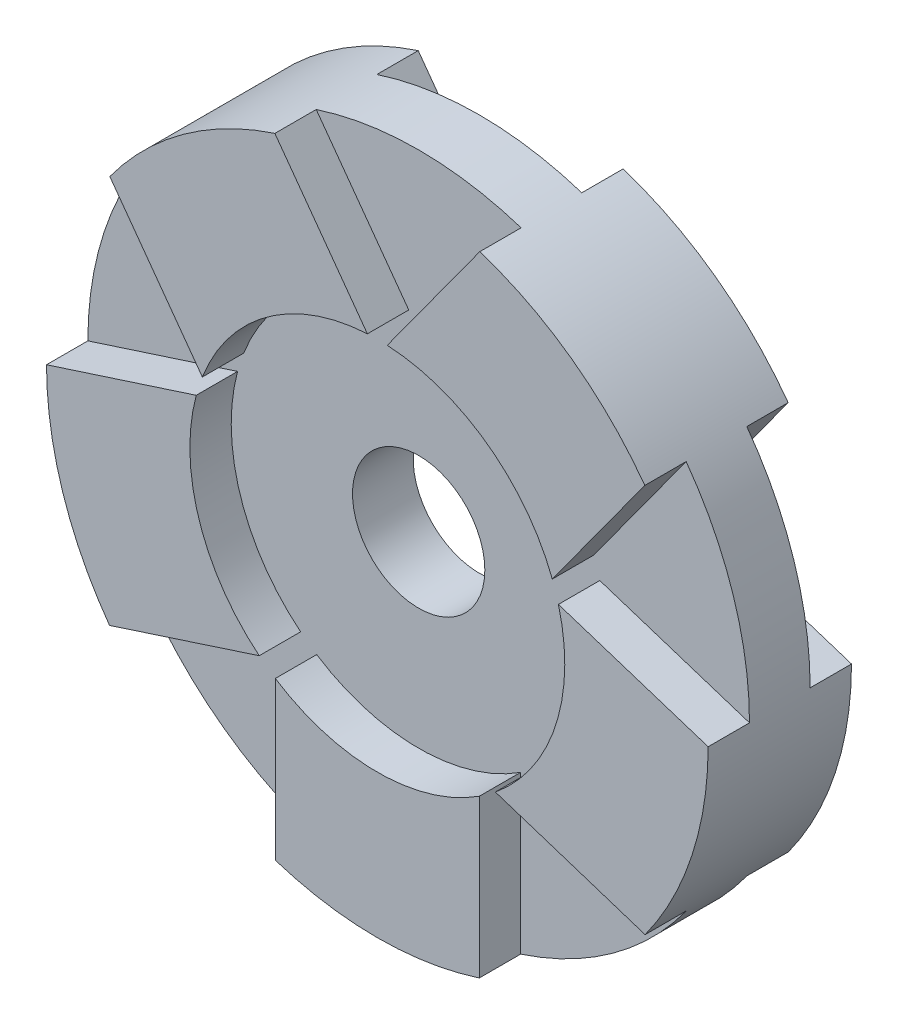
from build123d import *

# Parameters (mm, degrees)
BOSS_EXTRU_1_DEPTH      = 6.5
BOSS_EXTRU_1_DEPTH_BACK = 6.5
ESQUISSE1_R             = 30
ESQUISSE1_R_2           = 6
ESQUISSE3_R             = 6
ENL_V_MAT_EXTRU_1_DEPTH = 3.75


with BuildPart() as part:
    # Esquisse1 → Boss.-Extru.1 (new, two sides: drawn at the far end of the back side and taken through both)
    with BuildSketch(Plane.XY.offset(-BOSS_EXTRU_1_DEPTH_BACK)):
        Circle(ESQUISSE1_R)
        Circle(ESQUISSE1_R_2, mode=Mode.SUBTRACT)
    extrude(amount=BOSS_EXTRU_1_DEPTH + BOSS_EXTRU_1_DEPTH_BACK)

    # Esquisse3 → Enlèv. mat.-Extru.1 (cut)
    with BuildSketch(Plane.XY.offset(6.5)):
        with BuildLine():
            ThreePointArc((-9.25, -14.263151826), (0, -17), (9.25, -14.263151826))
            Line((9.25, -14.263151826), (9.25, -28.538351389))
            ThreePointArc((9.25, -28.538351389), (17.633557569, -24.270509831), (24.283177855, -17.616108346))
            Line((24.283177855, -17.616108346), (10.706656289, -13.204829083))
            ThreePointArc((10.706656289, -13.204829083), (16.167960777, -5.253288904), (16.423470685, 4.389716468))
            Line((16.423470685, 4.389716468), (30, 0))
            ThreePointArc((30, 0), (28.528362011, 9.280762952), (24.257829269, 17.650997681))
            Line((24.257829269, 17.650997681), (15.867077492, 6.102118637))
            ThreePointArc((15.867077492, 6.102118637), (9.992349289, 13.753288904), (0.900263096, 16.976145804))
            Line((0.900263096, 16.976145804), (9.291014873, 28.525024849))
            ThreePointArc((9.291014873, 28.525024849), (0, 30), (-9.291014873, 28.525024849))
            Line((-9.291014873, 28.525024849), (-0.900263096, 16.976145804))
            ThreePointArc((-0.900263096, 16.976145804), (-9.992349289, 13.753288904), (-15.867077492, 6.102118637))
            Line((-15.867077492, 6.102118637), (-24.257829269, 17.650997681))
            ThreePointArc((-24.257829269, 17.650997681), (-28.528362011, 9.280762952), (-30, 0))
            Line((-30, 0), (-16.423470685, 4.389716468))
            ThreePointArc((-16.423470685, 4.389716468), (-16.167960777, -5.253288904), (-10.706656289, -13.204829083))
            Line((-10.706656289, -13.204829083), (-24.283177855, -17.616108346))
            ThreePointArc((-24.283177855, -17.616108346), (-17.633557569, -24.270509831), (-9.25, -28.538351389))
            Line((-9.25, -28.538351389), (-9.25, -14.263151826))
        make_face()
        Circle(ESQUISSE3_R, mode=Mode.SUBTRACT)
    enl_v_mat_extru_1 = extrude(amount=-ENL_V_MAT_EXTRU_1_DEPTH, mode=Mode.SUBTRACT)

    # Symétrie1: Enlèv. mat.-Extru.1 across plane
    add(enl_v_mat_extru_1.mirror(Plane.XY), mode=Mode.SUBTRACT)


solid = part.part
